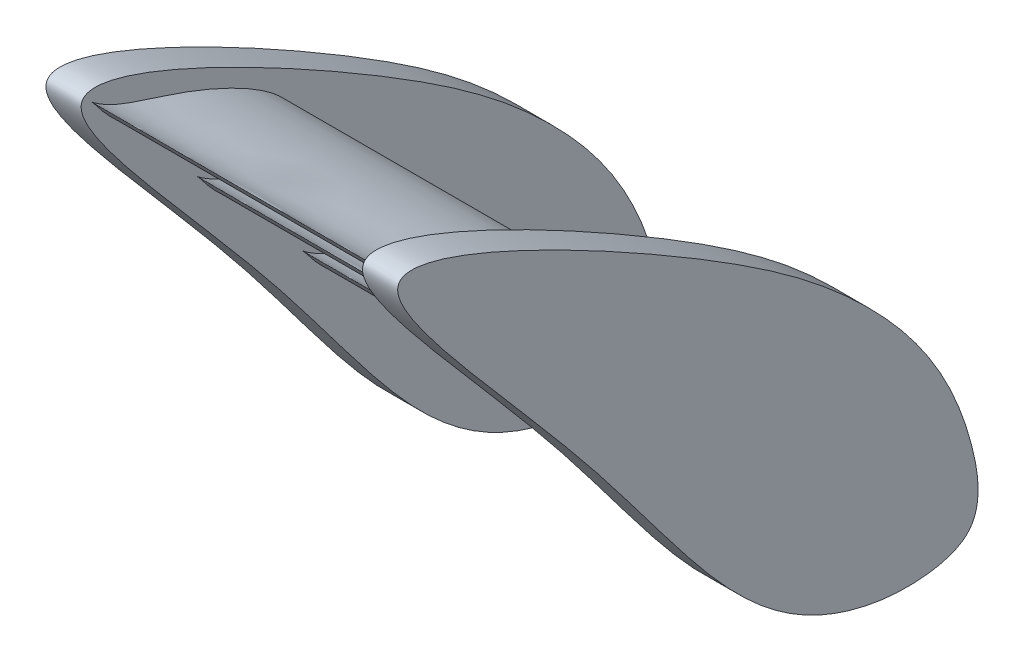
from build123d import *

# Parameters (mm, degrees)
BOSS_EXTRUDE1_DEPTH   = 3048
BOSS_EXTRUDE1_2_DEPTH = 3048
BOSS_EXTRUDE1_3_DEPTH = 3048
BOSS_EXTRUDE1_4_DEPTH = 3048
BOSS_EXTRUDE2_DEPTH   = 381
BOSS_EXTRUDE3_DEPTH   = 381


with BuildPart() as part:
    # Sketch2 → Boss-Extrude1 (new body)
    with BuildSketch(Plane(origin=(0, 0, 0), x_dir=(0, 0, -1), z_dir=(1, 0, 0))):
        with BuildLine():
            add(Edge.make_bspline(
                [(-2199.704525612, 1270), (-2199.77172316, 1269.894416752), (-2184.150214571, 1255.294789479), (-2171.146917364, 1238.694581179), (-2141.009188539, 1201.77526343), (-2107.90812585, 1158.170275244), (-2065.947783884, 1106.35183911), (-2015.401215634, 1050.474216705), (-1955.476722738, 990.49445476), (-1887.624456101, 925.942045726), (-1812.306736545, 857.836599846), (-1730.420171008, 787.246819452), (-1642.687197795, 715.323780938), (-1549.66976556, 643.194078182), (-1451.707444845, 572.029733417), (-1349.919484572, 502.142083455), (-1245.206807168, 434.133113279), (-1138.233886618, 369.143941073), (-1030.174557663, 307.378354177), (-922.184147878, 249.264192863), (-815.42594575, 195.408752637), (-711.073651251, 146.333461599), (-610.202935969, 102.575210071), (-513.891619605, 64.539877128), (-423.084891568, 32.625822249), (-338.739824847, 7.054019447), (-261.639118909, -11.953311497), (-192.607575531, -24.415074359), (-132.33152017, -30.410043594), (-81.548223525, -30.239608944), (-42.102113733, -24.479086366), (-19.322461251, -16.1688062), (-9.654190091, -10.032776582), (-6.297930687, -7.592844476), (-2.522575973, -4.207051694), (0.686459758, 0.92581912), (2.714712327, 5.589550631), (6.899112898, 18.02101456), (8.907566856, 41.700537757), (2.43057515, 78.329526522), (-13.3485833, 119.982771355), (-38.867273731, 165.652274889), (-74.268241002, 214.436405797), (-119.709168128, 265.719889747), (-175.061639185, 318.769117147), (-240.206005263, 373.117609103), (-314.722116679, 428.156308578), (-398.198853257, 483.518239012), (-489.921955412, 538.701409628), (-589.205298208, 593.393187654), (-695.048227449, 647.184714391), (-806.501823806, 699.787684), (-922.334044979, 750.790985816), (-1041.393362947, 799.953710469), (-1162.741917449, 846.408910013), (-1285.573466306, 890.324711476), (-1409.71270684, 930.527931012), (-1533.386363842, 969.732587465), (-1654.76855534, 1008.782558126), (-1771.200056312, 1048.485047477), (-1879.767899382, 1089.16633326), (-1975.932704505, 1131.046299236), (-2056.738297743, 1173.349038162), (-2117.090968385, 1209.451740593), (-2163.614474543, 1242.224058757), (-2182.59257725, 1255.545623013), (-2199.636749969, 1270.106491574), (-2199.704525612, 1270)],
                knots=[0, 0, 0, 0, 0.001960339, 0.007574308, 0.016161421, 0.02699837, 0.0396077, 0.053883797, 0.070024261, 0.087906941, 0.107283955, 0.12790895, 0.149540956, 0.17195646, 0.195007997, 0.218564284, 0.242344708, 0.266185529, 0.289916522, 0.313299755, 0.336095972, 0.358081305, 0.379036501, 0.398773908, 0.417106362, 0.433898183, 0.449004352, 0.462356228, 0.473857447, 0.483498302, 0.491230927, 0.496511194, 0.497120901, 0.497753896, 0.498878073, 0.499984363, 0.501173759, 0.50177282, 0.507458783, 0.514430222, 0.522855735, 0.532727756, 0.544176308, 0.5571546, 0.571742478, 0.587847191, 0.605491647, 0.62453282, 0.644934785, 0.666503992, 0.689144617, 0.712614857, 0.736760613, 0.761296557, 0.786046522, 0.810835887, 0.835658837, 0.860435805, 0.884807295, 0.908351097, 0.930578359, 0.950847936, 0.968252195, 0.982111179, 0.992068895, 0.998022796, 1, 1, 1, 1], degree=3))
        make_face()
    extrude(amount=BOSS_EXTRUDE1_DEPTH)



with BuildPart() as body_2:
    # Sketch2 → Boss-Extrude1 2 (new body)
    with BuildSketch(Plane(origin=(0, 0, 0), x_dir=(0, 0, -1), z_dir=(1, 0, 0))):
        with BuildLine():
            add(Edge.make_bspline(
                [(-1056.704525612, 0), (-1056.77172316, -0.105583248), (-1041.150214571, -14.705210521), (-1028.146917364, -31.305418821), (-998.009188539, -68.22473657), (-964.90812585, -111.829724756), (-922.947783884, -163.64816089), (-872.401215634, -219.525783295), (-812.476722738, -279.50554524), (-744.624456101, -344.057954274), (-669.306736545, -412.163400154), (-587.420171008, -482.753180548), (-499.687197795, -554.676219062), (-406.66976556, -626.805921818), (-308.707444845, -697.970266583), (-206.919484572, -767.857916545), (-102.206807168, -835.866886721), (4.766113382, -900.856058927), (112.825442337, -962.621645823), (220.815852122, -1020.735807137), (327.57405425, -1074.591247363), (431.926348749, -1123.666538401), (532.797064031, -1167.424789929), (629.108380395, -1205.460122872), (719.915108432, -1237.374177751), (804.260175153, -1262.945980553), (881.360881091, -1281.953311497), (950.392424469, -1294.415074359), (1010.66847983, -1300.410043594), (1061.451776475, -1300.239608944), (1100.897886267, -1294.479086366), (1123.677538749, -1286.1688062), (1133.345809909, -1280.032776582), (1136.702069313, -1277.592844476), (1140.477424027, -1274.207051694), (1143.686459758, -1269.07418088), (1145.714712327, -1264.410449369), (1149.899112898, -1251.97898544), (1151.907566856, -1228.299462243), (1145.43057515, -1191.670473478), (1129.6514167, -1150.017228645), (1104.132726269, -1104.347725111), (1068.731758998, -1055.563594203), (1023.290831872, -1004.280110253), (967.938360815, -951.230882853), (902.793994737, -896.882390897), (828.277883321, -841.843691422), (744.801146743, -786.481760988), (653.078044588, -731.298590372), (553.794701792, -676.606812346), (447.951772551, -622.815285609), (336.498176194, -570.212316), (220.665955021, -519.209014184), (101.606637053, -470.046289531), (-19.741917449, -423.591089987), (-142.573466306, -379.675288524), (-266.71270684, -339.472068988), (-390.386363842, -300.267412535), (-511.76855534, -261.217441874), (-628.200056312, -221.514952523), (-736.767899382, -180.83366674), (-832.932704505, -138.953700764), (-913.738297743, -96.650961838), (-974.090968385, -60.548259407), (-1020.614474543, -27.775941243), (-1039.59257725, -14.454376987), (-1056.636749969, 0.106491574), (-1056.704525612, 0)],
                knots=[0, 0, 0, 0, 0.001960339, 0.007574308, 0.016161421, 0.02699837, 0.0396077, 0.053883797, 0.070024261, 0.087906941, 0.107283955, 0.12790895, 0.149540956, 0.17195646, 0.195007997, 0.218564284, 0.242344708, 0.266185529, 0.289916522, 0.313299755, 0.336095972, 0.358081305, 0.379036501, 0.398773908, 0.417106362, 0.433898183, 0.449004352, 0.462356228, 0.473857447, 0.483498302, 0.491230927, 0.496511194, 0.497120901, 0.497753896, 0.498878073, 0.499984363, 0.501173759, 0.50177282, 0.507458783, 0.514430222, 0.522855735, 0.532727756, 0.544176308, 0.5571546, 0.571742478, 0.587847191, 0.605491647, 0.62453282, 0.644934785, 0.666503992, 0.689144617, 0.712614857, 0.736760613, 0.761296557, 0.786046522, 0.810835887, 0.835658837, 0.860435805, 0.884807295, 0.908351097, 0.930578359, 0.950847936, 0.968252195, 0.982111179, 0.992068895, 0.998022796, 1, 1, 1, 1], degree=3))
        make_face()
    extrude(amount=BOSS_EXTRUDE1_2_DEPTH)


with BuildPart() as body_3:
    # Sketch2 → Boss-Extrude1 3 (new body)
    with BuildSketch(Plane(origin=(0, 0, 0), x_dir=(0, 0, -1), z_dir=(1, 0, 0))):
        with BuildLine():
            add(Edge.make_bspline(
                [(86.295474388, -1270), (86.22827684, -1270.105583248), (101.849785429, -1284.705210521), (114.853082636, -1301.305418821), (144.990811461, -1338.22473657), (178.09187415, -1381.829724756), (220.052216116, -1433.64816089), (270.598784366, -1489.525783295), (330.523277262, -1549.50554524), (398.375543899, -1614.057954274), (473.693263455, -1682.163400154), (555.579828992, -1752.753180548), (643.312802205, -1824.676219062), (736.33023444, -1896.805921818), (834.292555155, -1967.970266583), (936.080515428, -2037.857916545), (1040.793192832, -2105.866886721), (1147.766113382, -2170.856058927), (1255.825442337, -2232.621645823), (1363.815852122, -2290.735807137), (1470.57405425, -2344.591247363), (1574.926348749, -2393.666538401), (1675.797064031, -2437.424789929), (1772.108380395, -2475.460122872), (1862.915108432, -2507.374177751), (1947.260175153, -2532.945980553), (2024.360881091, -2551.953311497), (2093.392424469, -2564.415074359), (2153.66847983, -2570.410043594), (2204.451776475, -2570.239608944), (2243.897886267, -2564.479086366), (2266.677538749, -2556.1688062), (2276.345809909, -2550.032776582), (2279.702069313, -2547.592844476), (2283.477424027, -2544.207051694), (2286.686459758, -2539.07418088), (2288.714712327, -2534.410449369), (2292.899112898, -2521.97898544), (2294.907566856, -2498.299462243), (2288.43057515, -2461.670473478), (2272.6514167, -2420.017228645), (2247.132726269, -2374.347725111), (2211.731758998, -2325.563594203), (2166.290831872, -2274.280110253), (2110.938360815, -2221.230882853), (2045.793994737, -2166.882390897), (1971.277883321, -2111.843691422), (1887.801146743, -2056.481760988), (1796.078044588, -2001.298590372), (1696.794701792, -1946.606812346), (1590.951772551, -1892.815285609), (1479.498176194, -1840.212316), (1363.665955021, -1789.209014184), (1244.606637053, -1740.046289531), (1123.258082551, -1693.591089987), (1000.426533694, -1649.675288524), (876.28729316, -1609.472068988), (752.613636158, -1570.267412535), (631.23144466, -1531.217441874), (514.799943688, -1491.514952523), (406.232100618, -1450.83366674), (310.067295495, -1408.953700764), (229.261702257, -1366.650961838), (168.909031615, -1330.548259407), (122.385525457, -1297.775941243), (103.40742275, -1284.454376987), (86.363250031, -1269.893508426), (86.295474388, -1270)],
                knots=[0, 0, 0, 0, 0.001960339, 0.007574308, 0.016161421, 0.02699837, 0.0396077, 0.053883797, 0.070024261, 0.087906941, 0.107283955, 0.12790895, 0.149540956, 0.17195646, 0.195007997, 0.218564284, 0.242344708, 0.266185529, 0.289916522, 0.313299755, 0.336095972, 0.358081305, 0.379036501, 0.398773908, 0.417106362, 0.433898183, 0.449004352, 0.462356228, 0.473857447, 0.483498302, 0.491230927, 0.496511194, 0.497120901, 0.497753896, 0.498878073, 0.499984363, 0.501173759, 0.50177282, 0.507458783, 0.514430222, 0.522855735, 0.532727756, 0.544176308, 0.5571546, 0.571742478, 0.587847191, 0.605491647, 0.62453282, 0.644934785, 0.666503992, 0.689144617, 0.712614857, 0.736760613, 0.761296557, 0.786046522, 0.810835887, 0.835658837, 0.860435805, 0.884807295, 0.908351097, 0.930578359, 0.950847936, 0.968252195, 0.982111179, 0.992068895, 0.998022796, 1, 1, 1, 1], degree=3))
        make_face()
    extrude(amount=BOSS_EXTRUDE1_3_DEPTH)


with BuildPart() as body_4:
    # Sketch2 → Boss-Extrude1 4 (new body)
    with BuildSketch(Plane(origin=(0, 0, 0), x_dir=(0, 0, -1), z_dir=(1, 0, 0))):
        with BuildLine():
            add(Edge.make_bspline(
                [(1229.295474388, -2540), (1229.22827684, -2540.105583248), (1244.849785429, -2554.705210521), (1257.853082636, -2571.305418821), (1287.990811461, -2608.22473657), (1321.09187415, -2651.829724756), (1363.052216116, -2703.64816089), (1413.598784366, -2759.525783295), (1473.523277262, -2819.50554524), (1541.375543899, -2884.057954274), (1616.693263455, -2952.163400154), (1698.579828992, -3022.753180548), (1786.312802205, -3094.676219062), (1879.33023444, -3166.805921818), (1977.292555155, -3237.970266583), (2079.080515428, -3307.857916545), (2183.793192832, -3375.866886721), (2290.766113382, -3440.856058927), (2398.825442337, -3502.621645823), (2506.815852122, -3560.735807137), (2613.57405425, -3614.591247363), (2717.926348749, -3663.666538401), (2818.797064031, -3707.424789929), (2915.108380395, -3745.460122872), (3005.915108432, -3777.374177751), (3090.260175153, -3802.945980553), (3167.360881091, -3821.953311497), (3236.392424469, -3834.415074359), (3296.66847983, -3840.410043594), (3347.451776475, -3840.239608944), (3386.897886267, -3834.479086366), (3409.677538749, -3826.1688062), (3419.345809909, -3820.032776582), (3422.702069313, -3817.592844476), (3426.477424027, -3814.207051694), (3429.686459758, -3809.07418088), (3431.714712327, -3804.410449369), (3435.899112898, -3791.97898544), (3437.907566856, -3768.299462243), (3431.43057515, -3731.670473478), (3415.6514167, -3690.017228645), (3390.132726269, -3644.347725111), (3354.731758998, -3595.563594203), (3309.290831872, -3544.280110253), (3253.938360815, -3491.230882853), (3188.793994737, -3436.882390897), (3114.277883321, -3381.843691422), (3030.801146743, -3326.481760988), (2939.078044588, -3271.298590372), (2839.794701792, -3216.606812346), (2733.951772551, -3162.815285609), (2622.498176194, -3110.212316), (2506.665955021, -3059.209014184), (2387.606637053, -3010.046289531), (2266.258082551, -2963.591089987), (2143.426533694, -2919.675288524), (2019.28729316, -2879.472068988), (1895.613636158, -2840.267412535), (1774.23144466, -2801.217441874), (1657.799943688, -2761.514952523), (1549.232100618, -2720.83366674), (1453.067295495, -2678.953700764), (1372.261702257, -2636.650961838), (1311.909031615, -2600.548259407), (1265.385525457, -2567.775941243), (1246.40742275, -2554.454376987), (1229.363250031, -2539.893508426), (1229.295474388, -2540)],
                knots=[0, 0, 0, 0, 0.001960339, 0.007574308, 0.016161421, 0.02699837, 0.0396077, 0.053883797, 0.070024261, 0.087906941, 0.107283955, 0.12790895, 0.149540956, 0.17195646, 0.195007997, 0.218564284, 0.242344708, 0.266185529, 0.289916522, 0.313299755, 0.336095972, 0.358081305, 0.379036501, 0.398773908, 0.417106362, 0.433898183, 0.449004352, 0.462356228, 0.473857447, 0.483498302, 0.491230927, 0.496511194, 0.497120901, 0.497753896, 0.498878073, 0.499984363, 0.501173759, 0.50177282, 0.507458783, 0.514430222, 0.522855735, 0.532727756, 0.544176308, 0.5571546, 0.571742478, 0.587847191, 0.605491647, 0.62453282, 0.644934785, 0.666503992, 0.689144617, 0.712614857, 0.736760613, 0.761296557, 0.786046522, 0.810835887, 0.835658837, 0.860435805, 0.884807295, 0.908351097, 0.930578359, 0.950847936, 0.968252195, 0.982111179, 0.992068895, 0.998022796, 1, 1, 1, 1], degree=3))
        make_face()
    extrude(amount=BOSS_EXTRUDE1_4_DEPTH)


with BuildPart() as part_1:
    add(part.part)

    add(body_2.part)  # Boss-Extrude2 merges body 2

    add(body_3.part)  # Boss-Extrude2 merges body 3

    add(body_4.part)  # Boss-Extrude2 merges body 4
    # Sketch3 → Boss-Extrude2 (add)
    with BuildSketch(Plane(origin=(0, 0, 0), x_dir=(0, 0, -1), z_dir=(1, 0, 0))):
        with BuildLine():
            add(Edge.make_bspline(
                [(-2294.806625723, 1336.914587546), (-2467.484746806, 1077.971922396), (360.32082886, -1825.343474608), (1546.553104813, -4080.18869489), (3277.922785293, -4303.754655118), (4060.813573854, -4160.716229274), (3859.422644495, -2685.139059119), (2844.443689766, -1372.301683419), (947.842200521, 53.487324268), (-2102.190359892, 1625.755865829), (-2294.806625723, 1336.914587546)],
                knots=[0, 0, 0, 0, 0.195822528, 0.428979192, 0.462085667, 0.497558075, 0.542262204, 0.669140412, 0.781566976, 1, 1, 1, 1], degree=3))
        make_face()
    extrude(amount=-BOSS_EXTRUDE2_DEPTH)

    # Sketch4 → Boss-Extrude3 (add)
    with BuildSketch(Plane(origin=(3048, 0, 0), x_dir=(0, 0, -1), z_dir=(1, 0, 0))):
        with BuildLine():
            add(Edge.make_bspline(
                [(-2294.806625723, 1336.914587546), (-2467.484746806, 1077.971922396), (360.32082886, -1825.343474608), (1546.553104813, -4080.18869489), (3277.922785293, -4303.754655118), (4060.813573854, -4160.716229274), (3859.422644495, -2685.139059119), (2844.443689766, -1372.301683419), (947.842200521, 53.487324268), (-2102.190359892, 1625.755865829), (-2294.806625723, 1336.914587546)],
                knots=[0, 0, 0, 0, 0.195822528, 0.428979192, 0.462085667, 0.497558075, 0.542262204, 0.669140412, 0.781566976, 1, 1, 1, 1], degree=3))
        make_face()
    extrude(amount=BOSS_EXTRUDE3_DEPTH)


solid = part_1.part
